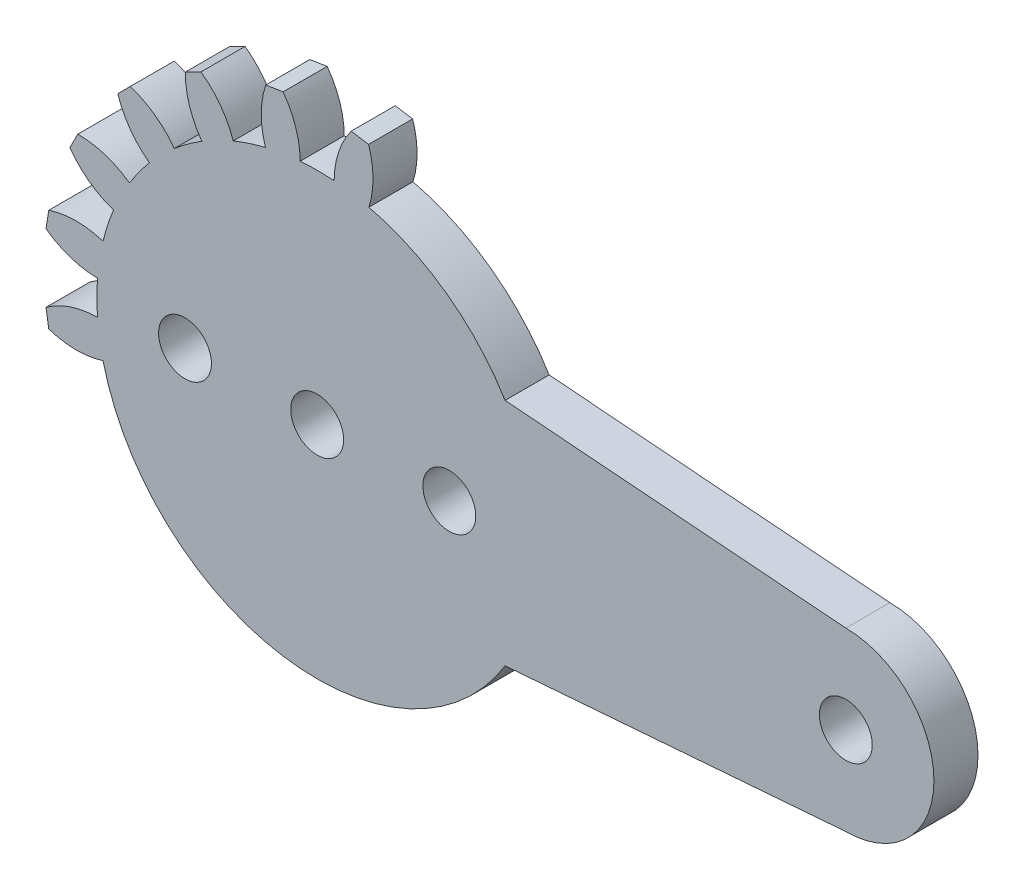
from build123d import *

# Parameters (mm, degrees)
SKETCH1_R           = 1.5
BOSS_EXTRUDE1_DEPTH = 2.5


with BuildPart() as part:
    # Sketch1 → Boss-Extrude1 (new body)
    with BuildSketch(Plane.XY):
        with BuildLine():
            Line((30, 5), (10.663780267, 6.521793497))
            ThreePointArc((10.663780267, 6.521793497), (7.359278279, 10.104010254), (2.936071308, 12.150287456))
            ThreePointArc((2.936071308, 12.150287456), (3.170504769, 13.6920006), (2.918578378, 15.230952047))
            Line((2.918578378, 15.230952047), (1.930890038, 15.387386512))
            ThreePointArc((1.930890038, 15.387386512), (1.215731652, 14.001606246), (0.962275561, 12.462905991))
            ThreePointArc((0.962275561, 12.462905991), (0, 12.5), (-0.962275561, 12.462905991))
            ThreePointArc((-0.962275561, 12.462905991), (-1.215731652, 14.001606246), (-1.930890038, 15.387386512))
            Line((-1.930890038, 15.387386512), (-2.918578378, 15.230952047))
            ThreePointArc((-2.918578378, 15.230952047), (-3.170504769, 13.6920006), (-2.936071308, 12.150287456))
            ThreePointArc((-2.936071308, 12.150287456), (-3.86271243, 11.888206454), (-4.766428193, 11.555568453))
            ThreePointArc((-4.766428193, 11.555568453), (-5.482963788, 12.940637118), (-6.591349484, 14.037596375))
            Line((-6.591349484, 14.037596375), (-7.482356008, 13.583605875))
            ThreePointArc((-7.482356008, 13.583605875), (-7.246390093, 12.042126537), (-6.54701506, 10.648314129))
            ThreePointArc((-6.54701506, 10.648314129), (-7.347315654, 10.11271243), (-8.104009624, 9.517091363))
            ThreePointArc((-8.104009624, 9.517091363), (-9.213485226, 10.612948266), (-10.606601718, 11.313708499))
            Line((-10.606601718, 11.313708499), (-11.313708499, 10.606601718))
            ThreePointArc((-11.313708499, 10.606601718), (-10.612948266, 9.213485226), (-9.517091363, 8.104009624))
            ThreePointArc((-9.517091363, 8.104009624), (-10.11271243, 7.347315654), (-10.648314129, 6.54701506))
            ThreePointArc((-10.648314129, 6.54701506), (-12.042126537, 7.246390093), (-13.583605875, 7.482356008))
            Line((-13.583605875, 7.482356008), (-14.037596375, 6.591349484))
            ThreePointArc((-14.037596375, 6.591349484), (-12.940637118, 5.482963788), (-11.555568453, 4.766428193))
            ThreePointArc((-11.555568453, 4.766428193), (-11.888206454, 3.86271243), (-12.150287456, 2.936071308))
            ThreePointArc((-12.150287456, 2.936071308), (-13.6920006, 3.170504769), (-15.230952047, 2.918578378))
            Line((-15.230952047, 2.918578378), (-15.387386512, 1.930890038))
            ThreePointArc((-15.387386512, 1.930890038), (-14.001606246, 1.215731652), (-12.462905991, 0.962275561))
            ThreePointArc((-12.462905991, 0.962275561), (-12.5, 0), (-12.462905991, -0.962275561))
            ThreePointArc((-12.462905991, -0.962275561), (-14.001606246, -1.215731652), (-15.387386512, -1.930890038))
            Line((-15.387386512, -1.930890038), (-15.230952047, -2.918578378))
            ThreePointArc((-15.230952047, -2.918578378), (-13.6920006, -3.170504769), (-12.150287456, -2.936071308))
            ThreePointArc((-12.150287456, -2.936071308), (-1.940818593, -12.348409743), (10.663780267, -6.521793497))
            Line((10.663780267, -6.521793497), (30, -5))
            ThreePointArc((30, -5), (35, 0), (30, 5))
        make_face()
        with Locations((30, 0)):
            Circle(SKETCH1_R, mode=Mode.SUBTRACT)
        Circle(SKETCH1_R, mode=Mode.SUBTRACT)
        with Locations((-7.5, 0)):
            Circle(SKETCH1_R, mode=Mode.SUBTRACT)
        with Locations(Location((7.5, 0, 0), (0, 0, 180))):
            Circle(SKETCH1_R, mode=Mode.SUBTRACT)
    extrude(amount=BOSS_EXTRUDE1_DEPTH)


solid = part.part
